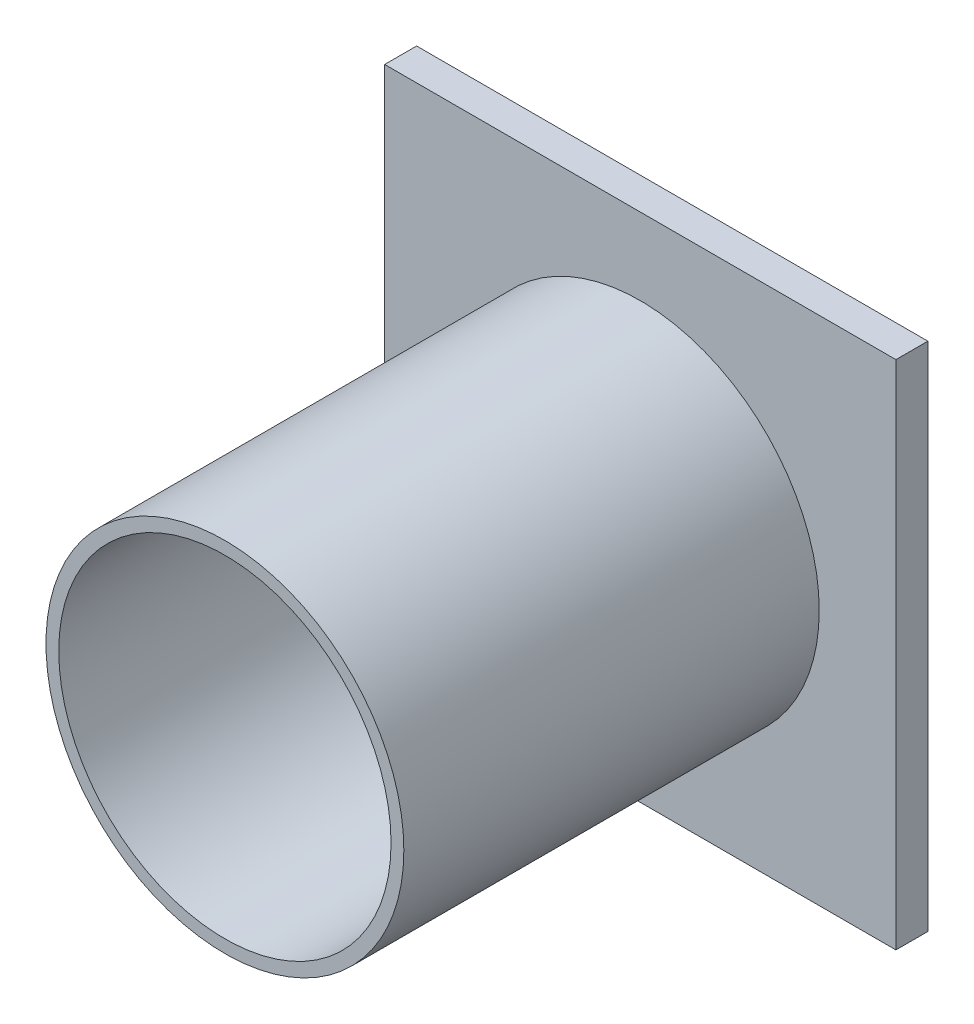
from build123d import *

# Parameters (mm, degrees)
SKETCH1_W           = 80
SKETCH1_H           = 80
BOSS_EXTRUDE1_DEPTH = 5
SKETCH2_R           = 28
SKETCH2_R_2         = 26
EXTRUDE_THIN1_DEPTH = 65


with BuildPart() as part:
    # Sketch1 → Boss-Extrude1 (new body)
    with BuildSketch(Plane.XY):
        with Locations((10.081300813, -11.056910569)):
            Rectangle(SKETCH1_W, SKETCH1_H)
    extrude(amount=BOSS_EXTRUDE1_DEPTH)

    # Sketch2 → Extrude-Thin1 (add)
    with BuildSketch(Plane.XY.offset(5)):
        with Locations((10.081300813, -11.056910569)):
            Circle(SKETCH2_R)
        with Locations((10.081300813, -11.056910569)):
            Circle(SKETCH2_R_2, mode=Mode.SUBTRACT)
    extrude(amount=EXTRUDE_THIN1_DEPTH)


solid = part.part
